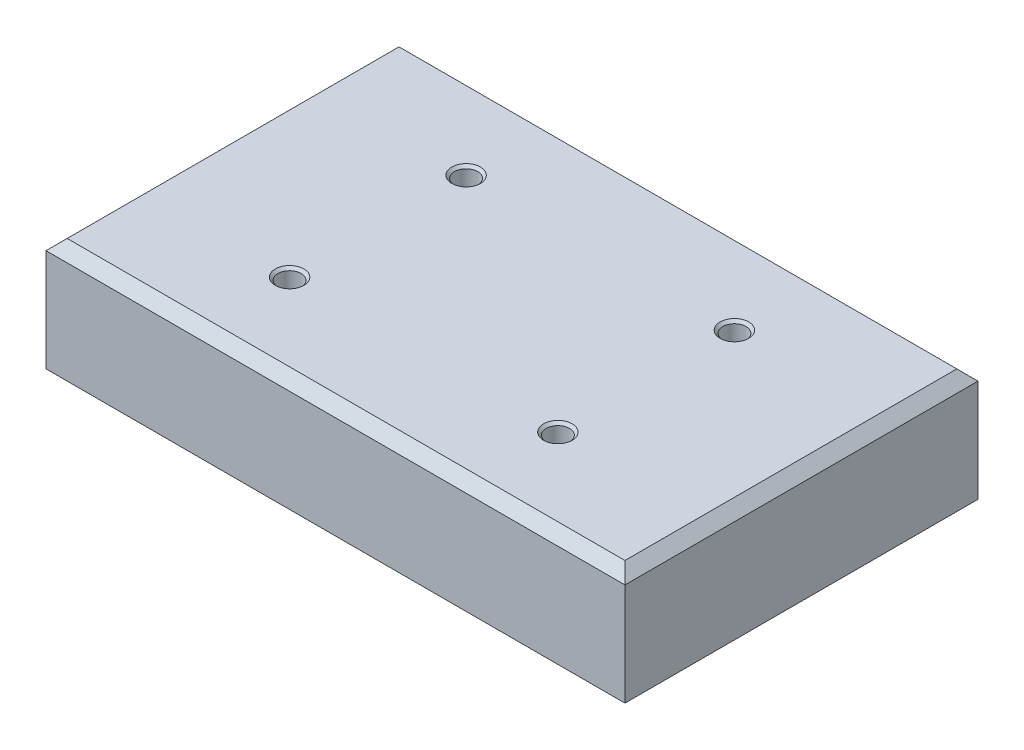
from build123d import *

# Parameters (mm, degrees)
SKETCH1_W                   = 82
SKETCH1_H                   = 50
BOSS_EXTRUDE1_DEPTH         = 8
CHAMFER1_SIZE               = 1.5
M4_TAPPED_HOLE1_D           = 3.3
M4_TAPPED_HOLE1_DEPTH       = 8
M4_TAPPED_HOLE1_CSINK_D     = 4.05
M4_TAPPED_HOLE1_CSINK_ANGLE = 90
M4_TAPPED_HOLE1_TIP         = 0.991420021


with BuildPart() as part:
    # Sketch1 → Boss-Extrude1 (new, symmetric)
    with BuildSketch(Plane(origin=(0, 0, 0), x_dir=(1, 0, 0), z_dir=(0, 1, 0))):
        Rectangle(SKETCH1_W, SKETCH1_H)
    extrude(amount=BOSS_EXTRUDE1_DEPTH, both=True)

    # Chamfer1
    chamfer1_edges = [part.edges().sort_by_distance(p)[0] for p in [
        (-41, 8, 0),
        (0, 8, 25),
        (41, 8, 0),
        (0, 8, -25),
    ]]
    chamfer(chamfer1_edges, length=CHAMFER1_SIZE)

    # M4 Tapped Hole1
    with Locations(Plane(origin=(0, 8, 0), x_dir=(1, 0, 0), z_dir=(0, 1, 0))):
        with Locations((19, 12.5), (19, -12.5), (-19, -12.5), (-19, 12.5)):
            CounterSinkHole(M4_TAPPED_HOLE1_D / 2, M4_TAPPED_HOLE1_CSINK_D / 2, depth=M4_TAPPED_HOLE1_DEPTH, counter_sink_angle=M4_TAPPED_HOLE1_CSINK_ANGLE)
            with Locations((0, 0, -(M4_TAPPED_HOLE1_DEPTH + M4_TAPPED_HOLE1_TIP / 2))):  # 118° drill point
                Cone(0, M4_TAPPED_HOLE1_D / 2, M4_TAPPED_HOLE1_TIP, mode=Mode.SUBTRACT)


solid = part.part
